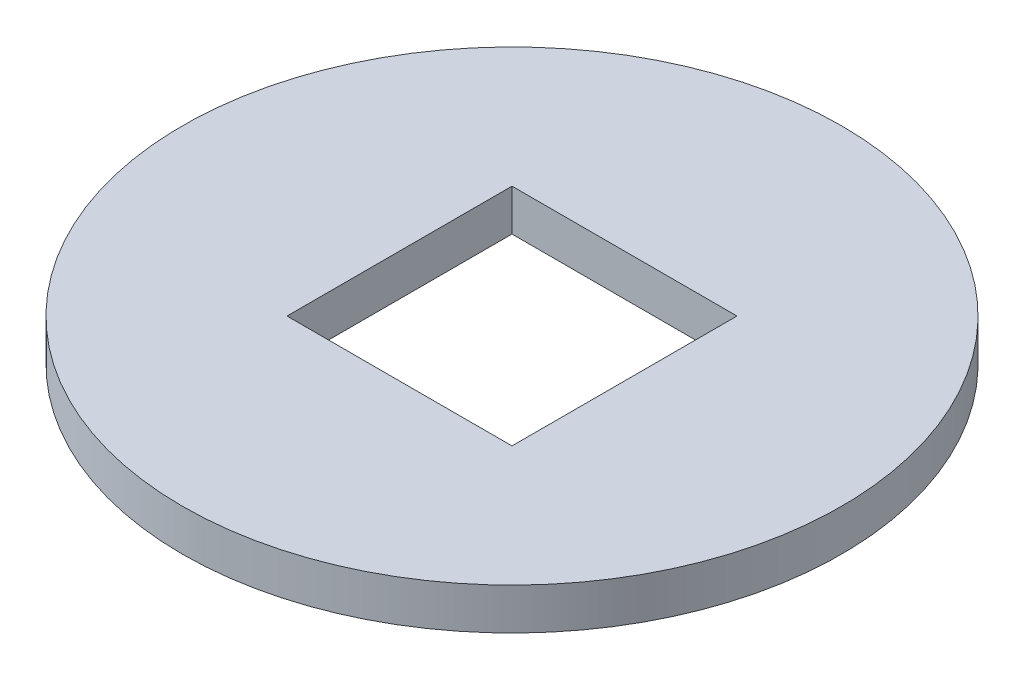
from build123d import *

# Parameters (mm, degrees)
SKETCH1_R           = 4.7625
SKETCH1_W           = 3.2512
SKETCH1_H           = 3.2512
BOSS_EXTRUDE1_DEPTH = 0.6


with BuildPart() as part:
    # Sketch1 → Boss-Extrude1 (new body)
    with BuildSketch(Plane(origin=(0, 0, 0), x_dir=(1, 0, 0), z_dir=(0, 1, 0))):
        with Locations(Location((0, 0, 0), (0, 0, 270))):
            Circle(SKETCH1_R)
        Rectangle(SKETCH1_W, SKETCH1_H, mode=Mode.SUBTRACT)
    extrude(amount=BOSS_EXTRUDE1_DEPTH)


solid = part.part
